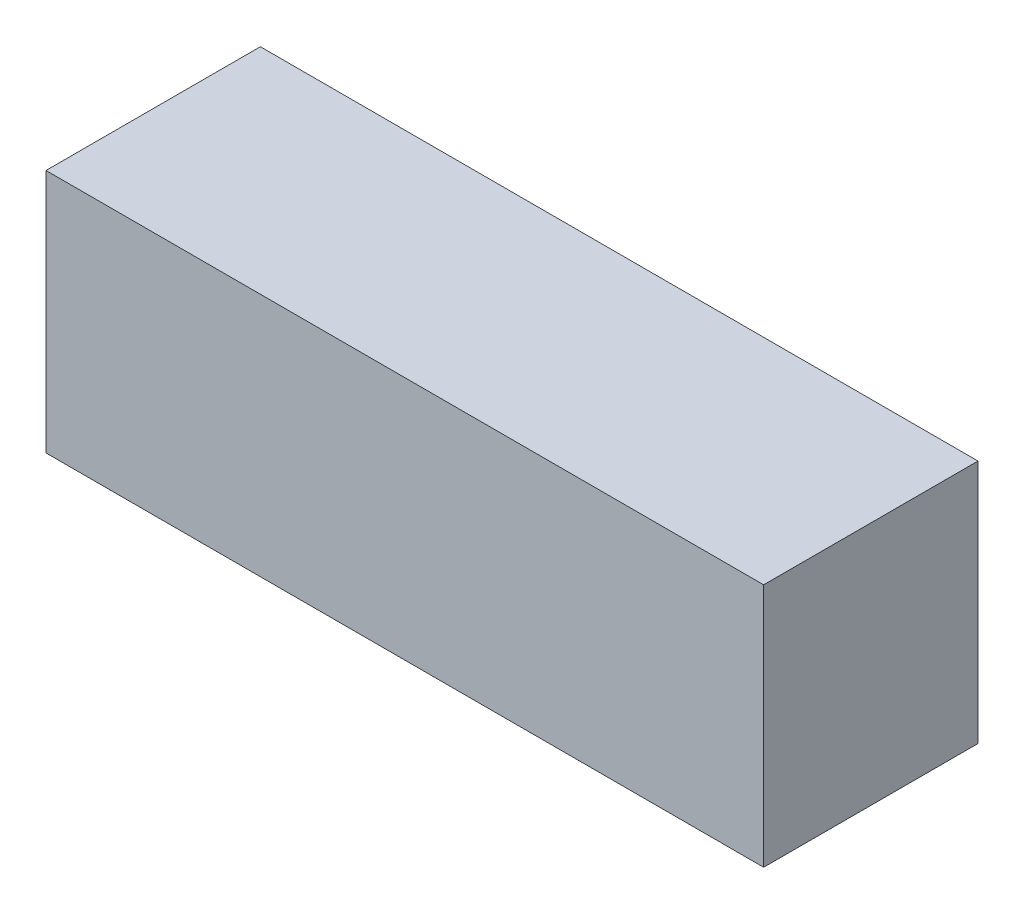
from build123d import *

# Parameters (mm, degrees)
SKETCH_2_W      = 46
SKETCH_2_H      = 52.5
EXTRUDE_1_DEPTH = 154


with BuildPart() as part:
    # 草图2 → 凸台-拉伸1 (new body)
    with BuildSketch(Plane(origin=(0, 0, 0), x_dir=(0, 0, -1), z_dir=(1, 0, 0))):
        Rectangle(SKETCH_2_W, SKETCH_2_H)
    extrude(amount=EXTRUDE_1_DEPTH)


solid = part.part
